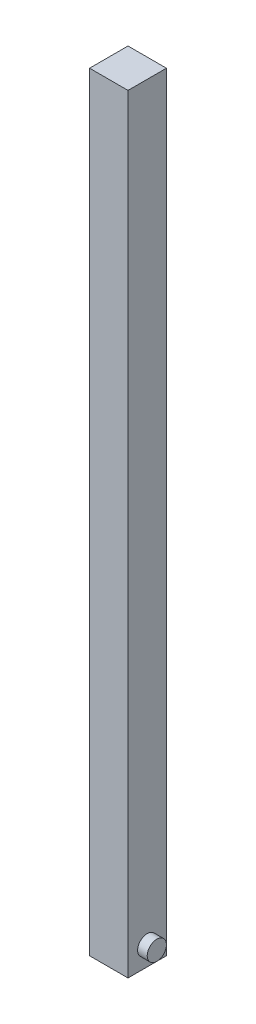
from build123d import *

# Parameters (mm, degrees)
SKETCH1_W           = 25.4
SKETCH1_H           = 25.4
BOSS_EXTRUDE2_DEPTH = 508
SKETCH3_R           = 6.35
BOSS_EXTRUDE4_DEPTH = 6.35


with BuildPart() as part:
    # Sketch1 → Boss-Extrude2 (new body)
    with BuildSketch(Plane(origin=(0, 0, 0), x_dir=(1, 0, 0), z_dir=(0, 1, 0))):
        with Locations((12.7, 12.7)):
            Rectangle(SKETCH1_W, SKETCH1_H)
    extrude(amount=BOSS_EXTRUDE2_DEPTH)

    # Sketch3 → Boss-Extrude4 (add)
    with BuildSketch(Plane(origin=(25.4, 0, 0), x_dir=(0, 0, -1), z_dir=(1, 0, 0))):
        with Locations(Location((12.7, 12.7, 0), (0, 0, 180))):
            Circle(SKETCH3_R)
    extrude(amount=BOSS_EXTRUDE4_DEPTH)


solid = part.part
